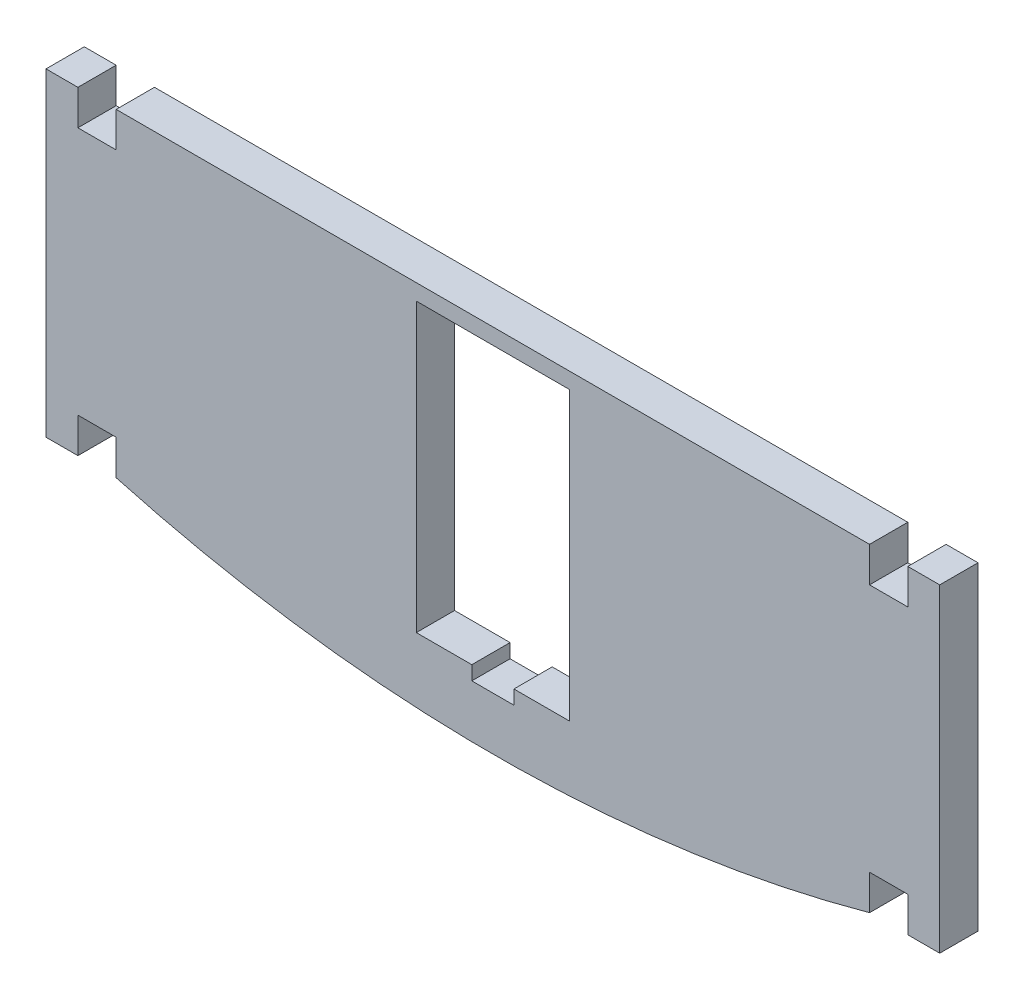
from build123d import *

# Parameters (mm, degrees)
AUFSATZ_LINEAR_AUSTRAGEN1_DEPTH      = 3
SCHNITT_LINEAR_AUSTRAGEN2_DEPTH      = 39.826708727
SCHNITT_LINEAR_AUSTRAGEN2_DEPTH_BACK = 39.826708727
SKIZZE5_W                            = 3.3
SKIZZE5_H                            = 1.1
SCHNITT_LINEAR_AUSTRAGEN3_DEPTH      = 10


with BuildPart() as part:
    # Skizze1 → Aufsatz-Linear austragen1 (new body)
    with BuildSketch(Plane.XY):
        with BuildLine():
            Line((-6, -11.25), (0, -11.25))
            Line((0, -11.25), (0, -16.5))
            ThreePointArc((0, -16.5), (-14.893915213, -15.49545091), (-29.518042644, -12.5))
            Line((-29.518042644, -12.5), (-29.518042644, -9.75))
            Line((-29.518042644, -9.75), (-32.518042644, -9.75))
            Line((-32.518042644, -9.75), (-32.518042644, -12.5))
            Line((-32.518042644, -12.5), (-35.018042644, -12.5))
            Line((-35.018042644, -12.5), (-35.018042644, 12.5))
            Line((-35.018042644, 12.5), (-32.518042644, 12.5))
            Line((-32.518042644, 12.5), (-32.518042644, 9.75))
            Line((-32.518042644, 9.75), (-29.518042644, 9.75))
            Line((-29.518042644, 9.75), (-29.518042644, 12.5))
            ThreePointArc((-29.518042644, 12.5), (-14.893915213, 15.49545091), (0, 16.5))
            Line((0, 16.5), (0, 11.25))
            Line((0, 11.25), (-6, 11.25))
            Line((-6, 11.25), (-6, -11.25))
        make_face()
    aufsatz_linear_austragen1 = extrude(amount=-AUFSATZ_LINEAR_AUSTRAGEN1_DEPTH)

    # Spiegeln1: Aufsatz-Linear austragen1 across plane
    add(aufsatz_linear_austragen1.mirror(Plane(origin=(0, 0, 0), x_dir=(0, 0, 1), z_dir=(1, 0, 0))))

    # Skizze2 → Schnitt-Linear austragen2 (cut, two sides: drawn at the far end of the back side and taken through both)
    with BuildSketch(Plane.XY.offset(-SCHNITT_LINEAR_AUSTRAGEN2_DEPTH_BACK)):
        Polygon((181.022901985, 12.5), (29.518042644, 12.5), (-29.518042644, 12.5), (-181.022901985, 12.5), (-181.022901985, 315.509718682), (181.022901985, 315.509718682), align=None)
    extrude(amount=SCHNITT_LINEAR_AUSTRAGEN2_DEPTH + SCHNITT_LINEAR_AUSTRAGEN2_DEPTH_BACK, mode=Mode.SUBTRACT)

    # Skizze5 → Schnitt-Linear austragen3 (cut)
    with BuildSketch(Plane.XY):
        with Locations((0, -11.8)):
            Rectangle(SKIZZE5_W, SKIZZE5_H)
    extrude(amount=-SCHNITT_LINEAR_AUSTRAGEN3_DEPTH, mode=Mode.SUBTRACT)


solid = part.part
